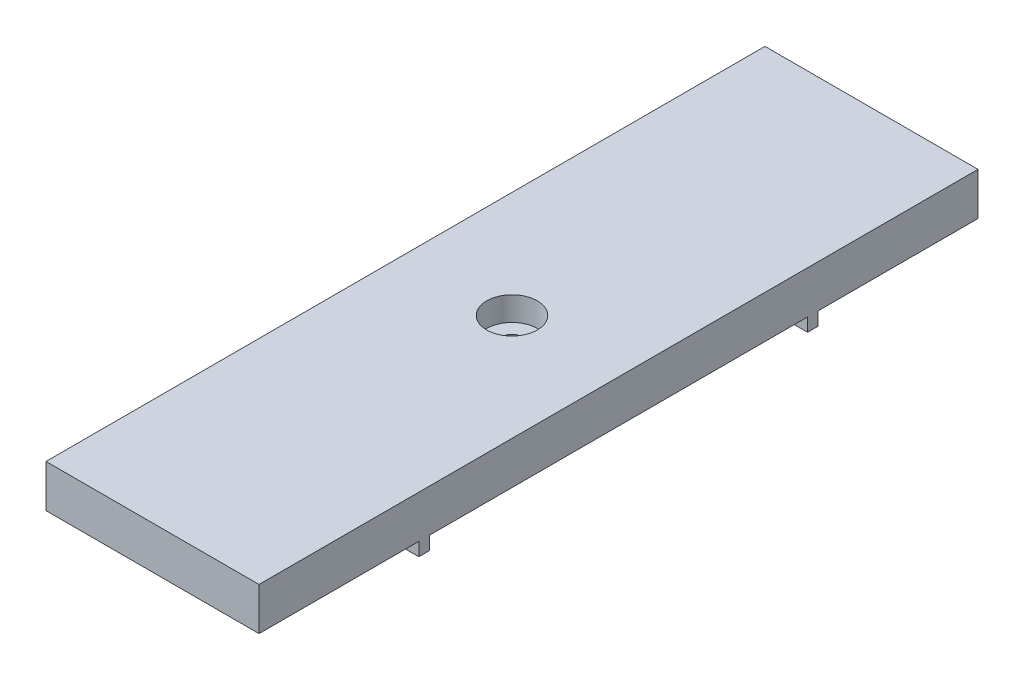
from build123d import *

# Parameters (mm, degrees)
SKETCH1_R           = 3.85
BOSS_EXTRUDE1_DEPTH = 15
SKETCH2_W           = 40
SKETCH2_H           = 135
BOSS_EXTRUDE3_DEPTH = 8
SKETCH3_W           = 40
SKETCH3_H           = 2
BOSS_EXTRUDE4_DEPTH = 2.5
SKETCH4_R           = 4.75
CUT_EXTRUDE1_DEPTH  = 4.5
SKETCH5_R           = 2
CUT_EXTRUDE2_DEPTH  = 11


with BuildPart() as part:
    # Sketch1 → Boss-Extrude1 (new body)
    with BuildSketch(Plane(origin=(0, 0, 0), x_dir=(1, 0, 0), z_dir=(0, 1, 0))):
        with Locations(Location((0, 0, 0), (0, 0, 270))):
            Circle(SKETCH1_R)
    extrude(amount=BOSS_EXTRUDE1_DEPTH)

    # Sketch2 → Boss-Extrude3 (add)
    with BuildSketch(Plane(origin=(0, 15, 0), x_dir=(1, 0, 0), z_dir=(0, 1, 0))):
        Rectangle(SKETCH2_W, SKETCH2_H)
    extrude(amount=BOSS_EXTRUDE3_DEPTH)

    # Sketch3 → Boss-Extrude4 (add)
    with BuildSketch(Plane.XZ.offset(-15)):
        with Locations((0, -36.5)):
            Rectangle(SKETCH3_W, SKETCH3_H)
        with Locations((0, 36.5)):
            Rectangle(SKETCH3_W, SKETCH3_H)
    extrude(amount=BOSS_EXTRUDE4_DEPTH)

    # Sketch4 → Cut-Extrude1 (cut)
    with BuildSketch(Plane(origin=(0, 23, 0), x_dir=(1, 0, 0), z_dir=(0, 1, 0))):
        with Locations(Location((0, 0, 0), (0, 0, 270))):
            Circle(SKETCH4_R)
    extrude(amount=-CUT_EXTRUDE1_DEPTH, mode=Mode.SUBTRACT)

    # Sketch5 → Cut-Extrude2 (cut)
    with BuildSketch(Plane(origin=(0, 18.5, 0), x_dir=(1, 0, 0), z_dir=(0, 1, 0))):
        with Locations(Location((0, 0, 0), (0, 0, 270))):
            Circle(SKETCH5_R)
    extrude(amount=-CUT_EXTRUDE2_DEPTH, mode=Mode.SUBTRACT)


solid = part.part
